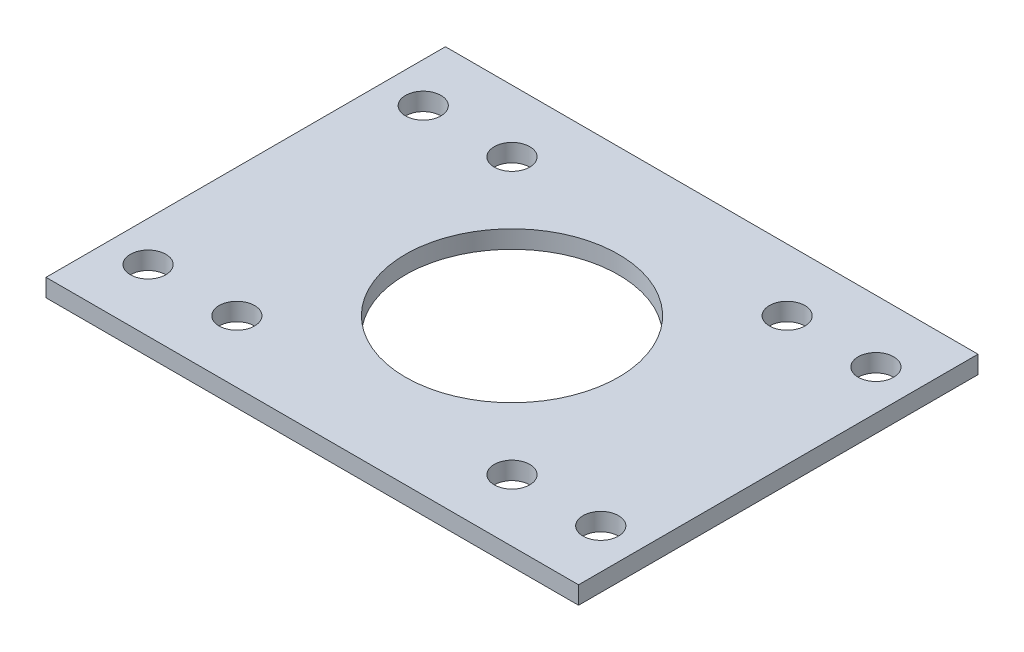
from build123d import *

# Parameters (mm, degrees)
SKETCH1_W           = 60
SKETCH1_H           = 45
SKETCH1_R           = 2
BOSS_EXTRUDE1_DEPTH = 2
SKETCH2_R           = 12
CUT_EXTRUDE1_DEPTH  = 38.553295461


with BuildPart() as part:
    # Sketch1 → Boss-Extrude1 (new body)
    with BuildSketch(Plane(origin=(0, 0, 0), x_dir=(1, 0, 0), z_dir=(0, 1, 0))):
        Rectangle(SKETCH1_W, SKETCH1_H)
        with Locations(Location((-15.5, 15.5, 0), (0, 0, 270))):
            Circle(SKETCH1_R, mode=Mode.SUBTRACT)
        with Locations(Location((15.5, 15.5, 0), (0, 0, 270))):
            Circle(SKETCH1_R, mode=Mode.SUBTRACT)
        with Locations(Location((15.5, -15.5, 0), (0, 0, 270))):
            Circle(SKETCH1_R, mode=Mode.SUBTRACT)
        with Locations(Location((-15.5, -15.5, 0), (0, 0, 270))):
            Circle(SKETCH1_R, mode=Mode.SUBTRACT)
        with Locations(Location((-25.5, 15.5, 0), (0, 0, 270))):
            Circle(SKETCH1_R, mode=Mode.SUBTRACT)
        with Locations(Location((-25.5, -15.5, 0), (0, 0, 270))):
            Circle(SKETCH1_R, mode=Mode.SUBTRACT)
        with Locations(Location((25.5, -15.5, 0), (0, 0, 270))):
            Circle(SKETCH1_R, mode=Mode.SUBTRACT)
        with Locations(Location((25.5, 15.5, 0), (0, 0, 270))):
            Circle(SKETCH1_R, mode=Mode.SUBTRACT)
    extrude(amount=BOSS_EXTRUDE1_DEPTH)

    # Sketch2 → Cut-Extrude1 (cut, through all)
    with BuildSketch(Plane(origin=(0, 2, 0), x_dir=(1, 0, 0), z_dir=(0, 1, 0))):
        with Locations(Location((0, 0, 0), (0, 0, 270))):
            Circle(SKETCH2_R)
    extrude(amount=-CUT_EXTRUDE1_DEPTH, mode=Mode.SUBTRACT)


solid = part.part
